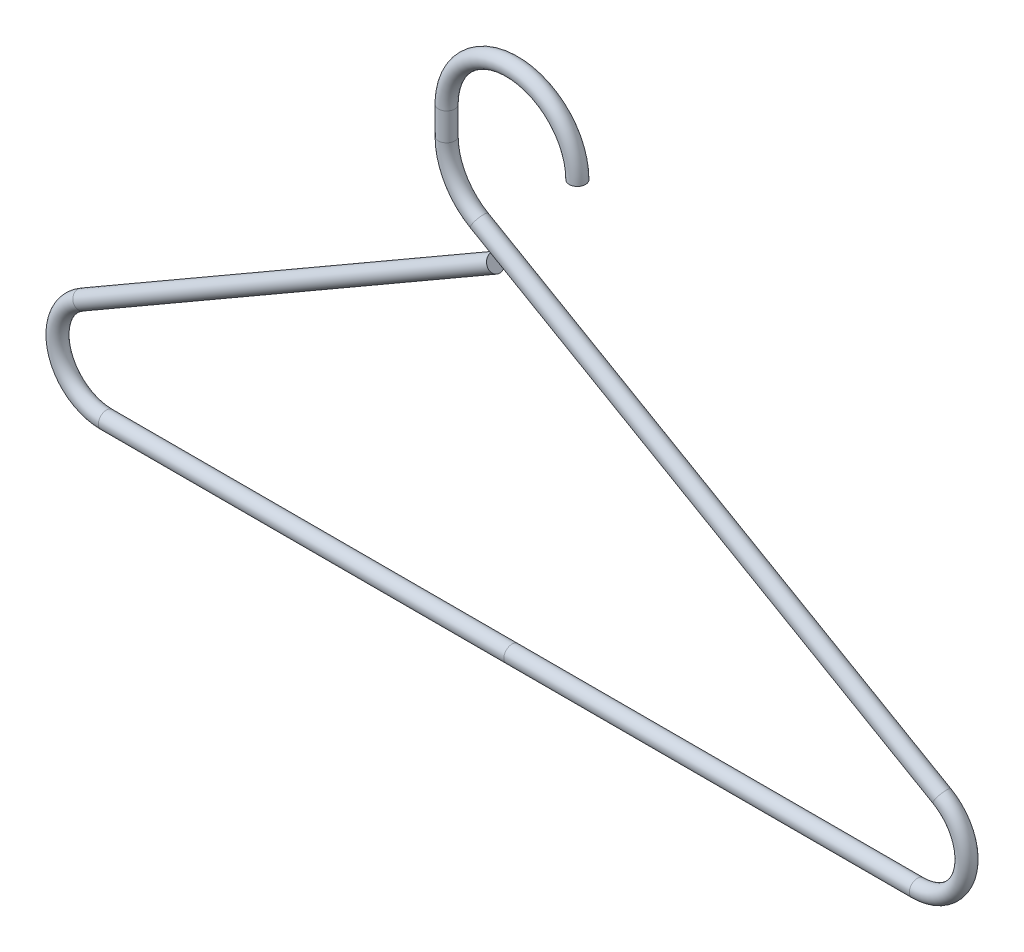
from build123d import *

# Parameters (mm, degrees)
SWEEP2_PROFILE_R = 3.175


with BuildPart() as part:
    # Sweep2: sweep along a path in Sketch1
    with BuildLine(Plane.XY) as sweep2_path:
        Line((-6.35, 128.316097327), (-167.029432116, 35.547783942))
        ThreePointArc((-167.029432116, 35.547783942), (-175.905319107, 14.119497191), (-157.504432116, 0))
        Line((-157.504432116, 0), (0, 0))
        Line((0, 0), (157.504432116, 0))
        ThreePointArc((157.504432116, 0), (175.905319107, 14.119497191), (167.029432116, 35.547783942))
        Line((167.029432116, 35.547783942), (-12.7, 139.314619955))
        ThreePointArc((-12.7, 139.314619955), (-21.997045256, 148.611665212), (-25.4, 161.311665212))
        Line((-25.4, 161.311665212), (-25.4, 172.046968374))
        ThreePointArc((-25.4, 172.046968374), (0, 197.446968374), (25.4, 172.046968374))
    # Sweep2 profile (on start of the path) → Sweep2 (sweep)
    with BuildSketch(Plane(origin=(-6.35, 128.316097327, 0), x_dir=(0.49999999999999517, -0.8660254037844415, 0), z_dir=(-0.8660254037844415, -0.49999999999999517, 0))):
        Circle(SWEEP2_PROFILE_R)
    sweep(path=sweep2_path.line)


solid = part.part
